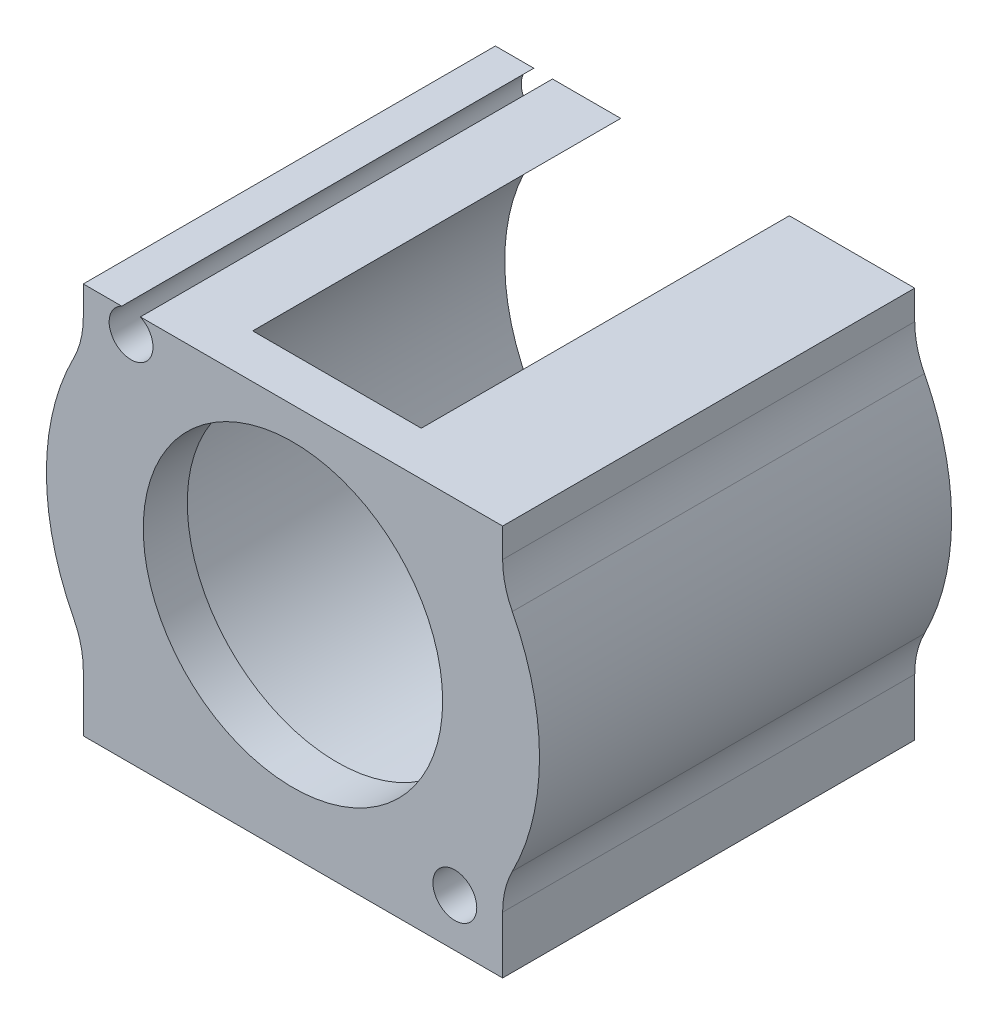
from build123d import *

# Parameters (mm, degrees)
SKETCH1_W               = 47.625
SKETCH1_H               = 47.625
SKETCH1_R               = 22.75
SKETCH1_R_2             = 2.4892
BOSS_EXTRUDE1_DEPTH     = 46.8
CUT_EXTRUDE1_DEPTH      = 58.656832314
CUT_EXTRUDE1_DEPTH_BACK = 58.656832314
SKETCH2_W               = 47.625
SKETCH2_H               = 3.175
BOSS_EXTRUDE2_DEPTH     = 46.8
FILLET1_R               = 10
BOSS_EXTRUDE3_START     = -5
SKETCH4_R               = 17
BOSS_EXTRUDE3_DEPTH     = 5


with BuildPart() as part:
    # Sketch1 → Boss-Extrude1 (new body)
    with BuildSketch(Plane.XY):
        Rectangle(SKETCH1_W, SKETCH1_H)
        Circle(SKETCH1_R, mode=Mode.SUBTRACT)
        with Locations((-18.384776311, 18.384776311)):
            Circle(SKETCH1_R_2, mode=Mode.SUBTRACT)
        with Locations((18.384776311, -18.384776311)):
            Circle(SKETCH1_R_2, mode=Mode.SUBTRACT)
    extrude(amount=BOSS_EXTRUDE1_DEPTH)

    # Sketch2 → Cut-Extrude1 (cut, two sides: drawn at the far end of the back side and taken through both)
    with BuildSketch(Plane.XY.offset(46.8).offset(-CUT_EXTRUDE1_DEPTH_BACK)):
        with Locations((0, 22.225)):
            Rectangle(SKETCH2_W, SKETCH2_H)
    extrude(amount=CUT_EXTRUDE1_DEPTH + CUT_EXTRUDE1_DEPTH_BACK, mode=Mode.SUBTRACT)

    # Sketch3 → Boss-Extrude2 (add)
    with BuildSketch(Plane.XY.offset(46.8)):
        with BuildLine():
            Line((23.8125, -14.729726533), (23.8125, 14.729726533))
            ThreePointArc((23.8125, 14.729726533), (28, 0), (23.8125, -14.729726533))
        make_face()
        with BuildLine():
            Line((-23.8125, 14.729726533), (-23.8125, -14.729726533))
            ThreePointArc((-23.8125, -14.729726533), (-28, 0), (-23.8125, 14.729726533))
        make_face()
    extrude(amount=-BOSS_EXTRUDE2_DEPTH)

    # Fillet1
    fillet1_edges = [part.edges().sort_by_distance(p)[0] for p in [
        (-23.8125, -14.729726533, 23.4),
        (-23.8125, 14.729726533, 23.4),
        (23.8125, 14.729726533, 23.4),
        (23.8125, -14.729726533, 23.4),
    ]]
    fillet(fillet1_edges, radius=FILLET1_R)

    # Sketch4 → Boss-Extrude3 (add)
    with BuildSketch(Plane.XY.offset(46.8).offset(BOSS_EXTRUDE3_START)):
        with BuildLine():
            Line((-9.573718909, 20.6375), (9.573718909, 20.6375))
            ThreePointArc((9.573718909, 20.6375), (0, -22.75), (-9.573718909, 20.6375))
        make_face()
        Circle(SKETCH4_R, mode=Mode.SUBTRACT)
    extrude(amount=BOSS_EXTRUDE3_DEPTH)


solid = part.part
